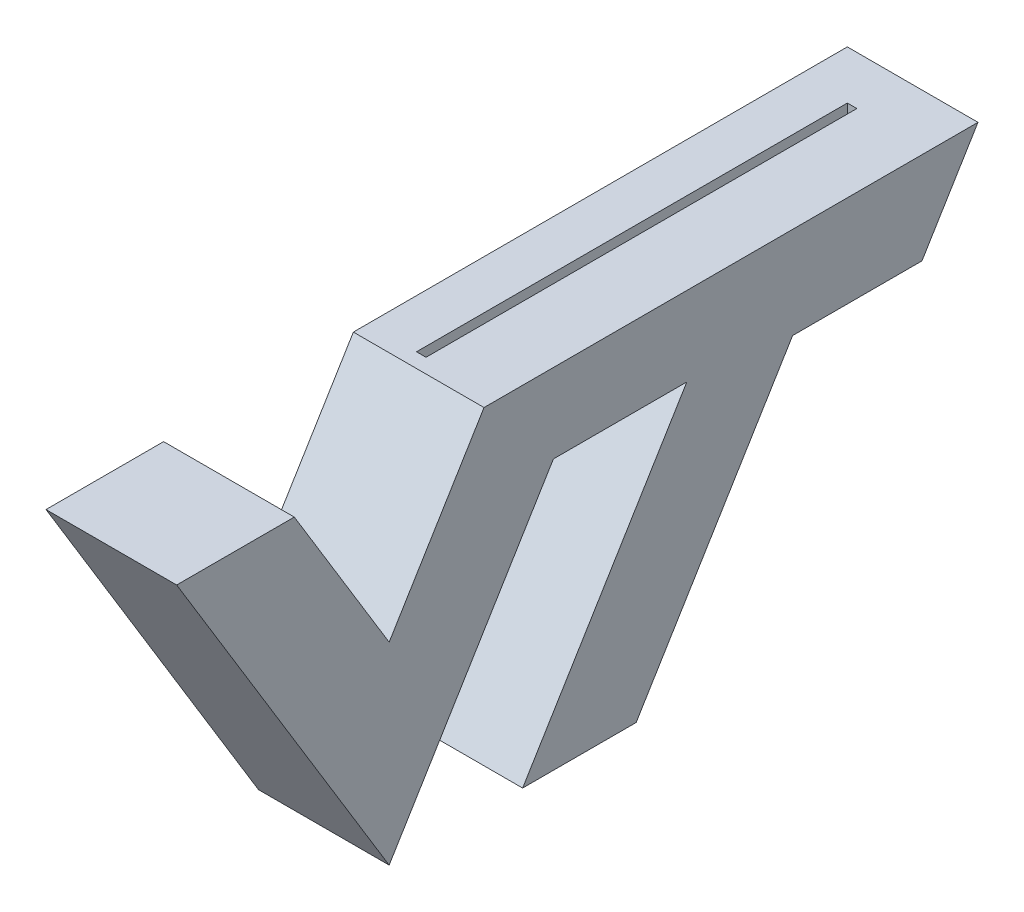
from build123d import *

# Parameters (mm, degrees)
BOSS_EXTRUDE3_DEPTH = 25.4
CUT_EXTRUDE2_START  = 2.54
CUT_EXTRUDE2_DEPTH  = 20.32
SKETCH4_W           = 11.045594529
SKETCH4_H           = 88.9
SKETCH4_W_2         = 1.520449279
SKETCH4_H_2         = 82.973089228
BOSS_EXTRUDE4_DEPTH = 11.684
SKETCH6_W           = 1.855490656
SKETCH6_H           = 83.744478267
CUT_EXTRUDE4_DEPTH  = 12.7


with BuildPart() as part:
    # Sketch1 → Boss-Extrude3 (new body)
    with BuildSketch(Plane(origin=(0, 0, 0), x_dir=(0, 0, -1), z_dir=(1, 0, 0))):
        Polygon((-80.07339815, 20.92975129), (-48.153855616, -31.475467797), (-16.234313081, 20.92975129), (9.704221599, 20.92975129), (-22.215320936, -31.475467797), (-0.147855616, -31.475467797), (30.261707149, 18.450680026), (55.407707149, 18.450680026), (66.298249821, 36.330675457), (-29.713750179, 36.330675457), (-48.153855616, 6.055875486), (-66.593961052, 36.330675457), (-89.453961052, 36.330675457), align=None)
    extrude(amount=BOSS_EXTRUDE3_DEPTH)

    # Sketch1<7> → Cut-Extrude2 (cut)
    with BuildSketch(Plane(origin=(0, 0, 0), x_dir=(0, 0, -1), z_dir=(1, 0, 0)).offset(CUT_EXTRUDE2_START)):
        Polygon((-73.682530671, 21.423584358), (-48.153855616, -20.489165733), (-20.954995017, 24.165680026), (17.574318407, 24.165680026), (-12.835244358, -25.760467797), (-3.358557782, -25.760467797), (27.051004983, 24.165680026), (52.197004983, 24.165680026), (56.125638564, 30.615675457), (-26.503048012, 30.615675457), (-48.153855616, -4.930426578), (-69.804663219, 30.615675457), (-79.281349795, 30.615675457), align=None)
    extrude(amount=CUT_EXTRUDE2_DEPTH, mode=Mode.SUBTRACT)

    # Sketch4 → Boss-Extrude4 (add)
    with BuildSketch(Plane(origin=(0, 36.330675457, 0), x_dir=(1, 0, 0), z_dir=(0, 1, 0))):
        with Locations((10.519546417, 14.736249821)):
            Rectangle(SKETCH4_W, SKETCH4_H)
        with Locations((10.202119042, 15.247213808)):
            Rectangle(SKETCH4_W_2, SKETCH4_H_2, mode=Mode.SUBTRACT)
    extrude(amount=-BOSS_EXTRUDE4_DEPTH)

    # Sketch6 → Cut-Extrude4 (cut)
    with BuildSketch(Plane(origin=(0, 36.330675457, 0), x_dir=(1, 0, 0), z_dir=(0, 1, 0))):
        with Locations((10.379765694, 14.977090577)):
            Rectangle(SKETCH6_W, SKETCH6_H)
    extrude(amount=-CUT_EXTRUDE4_DEPTH, mode=Mode.SUBTRACT)


solid = part.part
